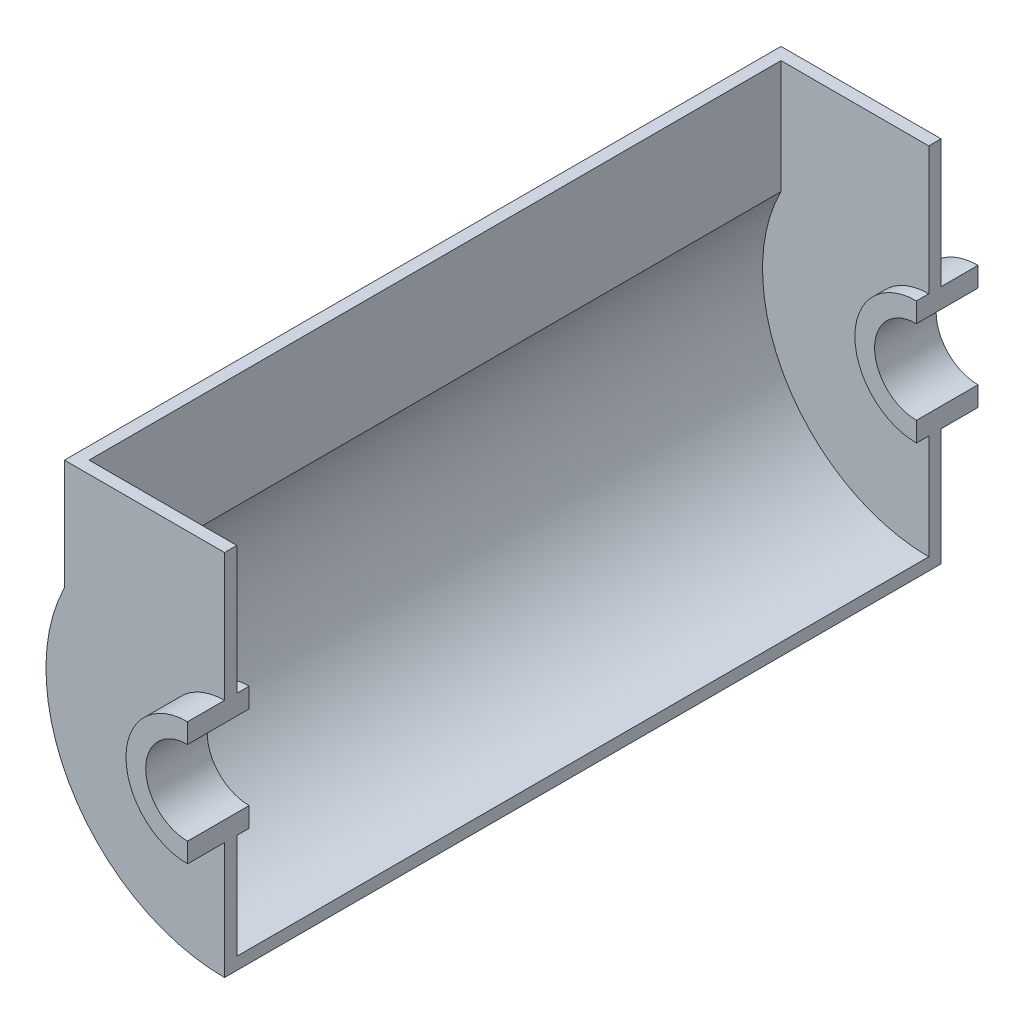
from build123d import *

# Parameters (mm, degrees)
BOSS_EXTRUDE1_DEPTH      = 20
BOSS_EXTRUDE1_DEPTH_BACK = 5
BOSS_EXTRUDE2_DEPTH      = 5
BOSS_EXTRUDE3_START      = 281
BOSS_EXTRUDE3_DEPTH      = 281


with BuildPart() as part:
    # Sketch1 → Boss-Extrude1 (new, two sides: drawn at the far end of the back side and taken through both)
    with BuildSketch(Plane.XY.offset(-BOSS_EXTRUDE1_DEPTH_BACK)):
        with BuildLine():
            Line((0, 25), (0, 17))
            ThreePointArc((0, 17), (-17, 0), (0, -17))
            Line((0, -17), (0, -25))
            ThreePointArc((0, -25), (-25, 0), (0, 25))
        make_face()
    extrude(amount=BOSS_EXTRUDE1_DEPTH + BOSS_EXTRUDE1_DEPTH_BACK)

    # Sketch2 → Boss-Extrude2 (add)
    with BuildSketch(Plane.XY):
        with BuildLine():
            Line((0, 25), (0, 77))
            Line((0, 77), (-65, 77))
            Line((-65, 77), (-65, 32.113081447))
            ThreePointArc((-65, 32.113081447), (-61.581037686, -38.262590053), (0, -72.5))
            Line((0, -72.5), (0, -25))
            ThreePointArc((0, -25), (-25, 0), (0, 25))
        make_face()
    extrude(amount=BOSS_EXTRUDE2_DEPTH)


with BuildPart() as body_2:
    # Mirror10: mirrored copy
    add(part.part.mirror(Plane.XY.offset(-140.5)))


with BuildPart() as part_1:
    add(part.part)

    add(body_2.part)  # Boss-Extrude3 merges body 2
    # Sketch3 → Boss-Extrude3 (add)
    with BuildSketch(Plane(origin=(0, 0, 0), x_dir=(-1, 0, 0), z_dir=(0, 0, -1)).offset(BOSS_EXTRUDE3_START)):
        with BuildLine():
            Line((65, 77), (65, 32.113081447))
            ThreePointArc((65, 32.113081447), (61.581037686, -38.262590053), (0, -72.5))
            Line((0, -72.5), (0, -67.5))
            ThreePointArc((0, -67.5), (57.634938288, -35.134938288), (60, 30.923292192))
            Line((60, 30.923292192), (60, 77))
            Line((60, 77), (65, 77))
        make_face()
    extrude(amount=-BOSS_EXTRUDE3_DEPTH)


solid = part_1.part
